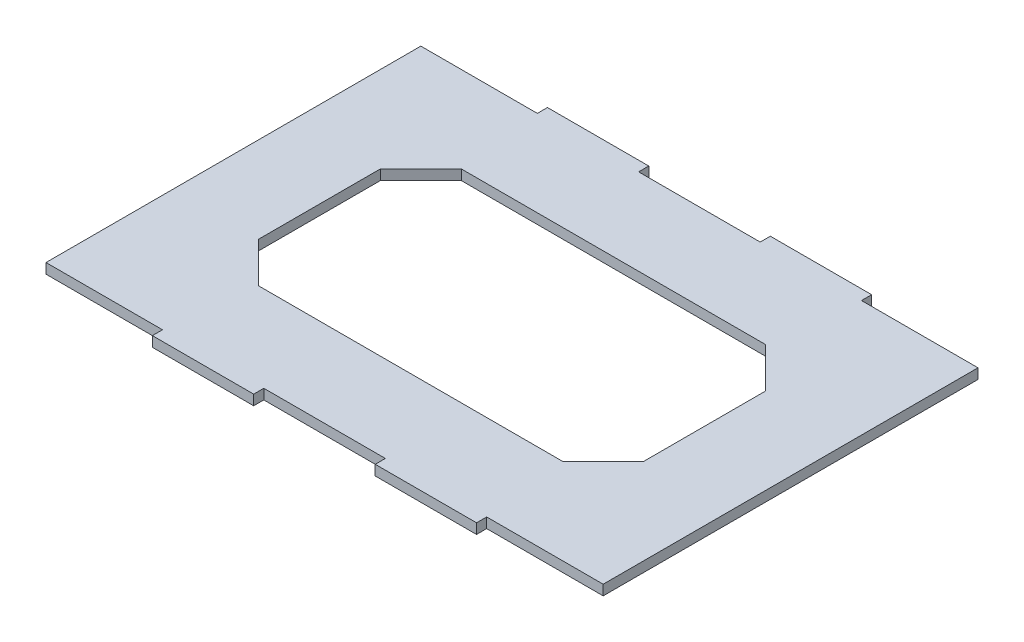
from build123d import *

# Parameters (mm, degrees)
BOSS_EXTRU_1_DEPTH = 10


with BuildPart() as part:
    # Esquisse1 → Boss.-Extru.1 (new body)
    with BuildSketch(Plane(origin=(0, 0, 0), x_dir=(1, 0, 0), z_dir=(0, 1, 0))):
        Polygon((0, 10), (115, 10), (115, 0), (215, 0), (215, 10), (335, 10), (335, 0), (435, 0), (435, 10), (550, 10), (550, 380), (435, 380), (435, 390), (335, 390), (335, 380), (215, 380), (215, 390), (115, 390), (115, 380), (0, 380), align=None)
        Polygon((85, 135), (125, 95), (425, 95), (465, 135), (465, 255), (425, 295), (125, 295), (85, 255), align=None, mode=Mode.SUBTRACT)
    extrude(amount=BOSS_EXTRU_1_DEPTH)


solid = part.part
